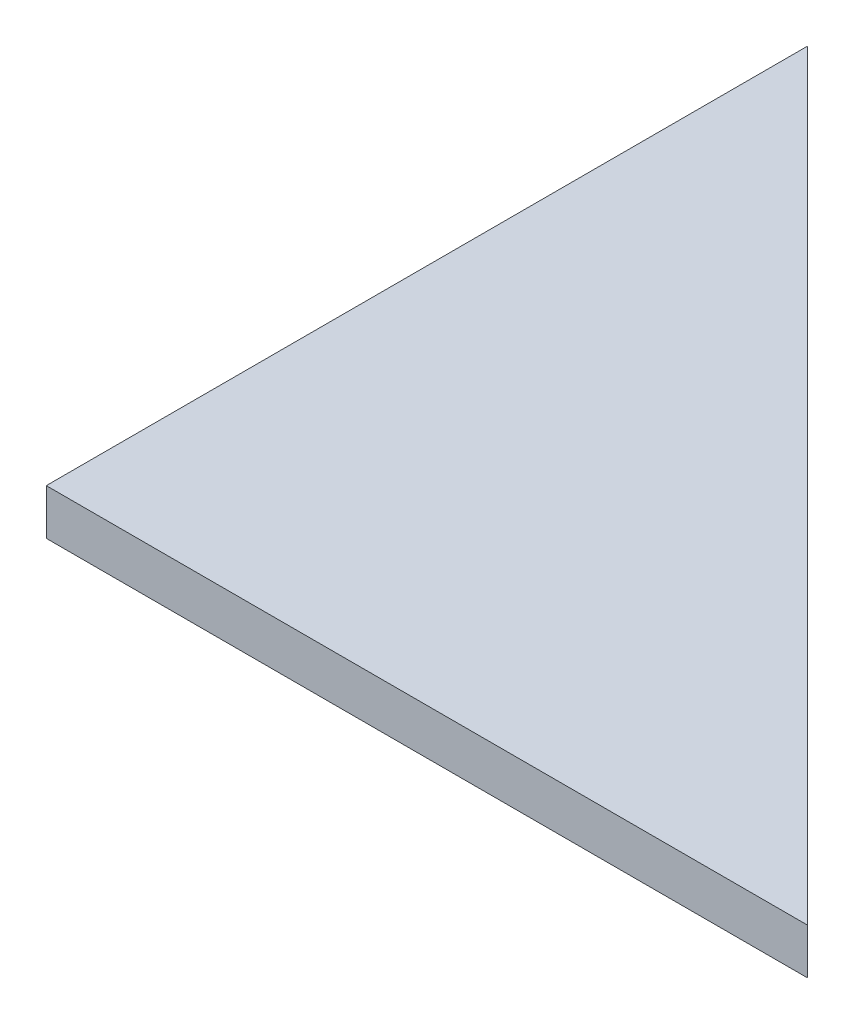
from build123d import *

# Parameters (mm, degrees)
P_IDAT_VYSUNUT_M1_DEPTH = 3


with BuildPart() as part:
    # Skica1 → Přidat vysunutím1 (new body)
    with BuildSketch(Plane(origin=(0, 0, 0), x_dir=(1, 0, 0), z_dir=(0, 1, 0))):
        Polygon((0, 0), (0, 50), (50, 0), align=None)
    extrude(amount=P_IDAT_VYSUNUT_M1_DEPTH)


solid = part.part
